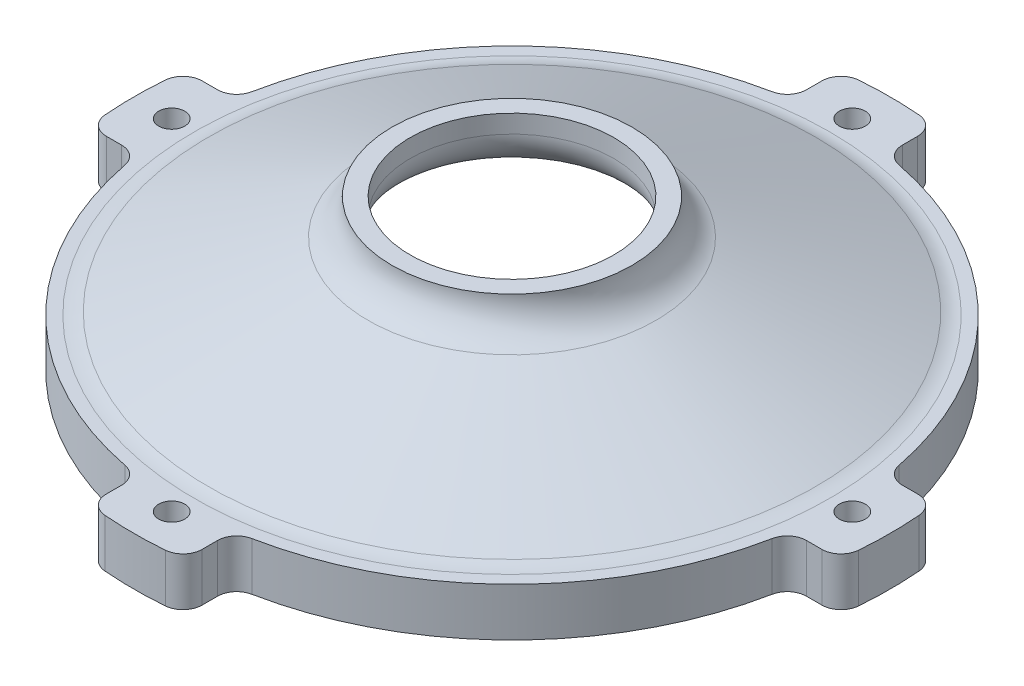
from build123d import *

# Parameters (mm, degrees)
F_18_0_1695_DIAMETER_HOLE1_D     = 4.3053
F_18_0_1695_DIAMETER_HOLE1_DEPTH = 38.1
F_18_0_1695_DIAMETER_HOLE1_TIP   = 1.293442612
CUT_EXTRUDE1_DEPTH               = 28


with BuildPart() as part:
    # Sketch2 → Revolve1 (revolve)
    with BuildSketch(Plane.XY, mode=Mode.PRIVATE) as revolve1_sk:
        with BuildLine():
            Line((50, 0), (62.5, 0))
            Line((62.5, 0), (62.5, 7.982495649))
            Line((62.5, 7.982495649), (52.5, 7.982495649))
            ThreePointArc((52.5, 7.982495649), (51.285053929, 8.09980714), (50.114998295, 8.447407131))
            Line((50.114998295, 8.447407131), (23.792498295, 19.114911482))
            ThreePointArc((23.792498295, 19.114911482), (20.911227085, 21.451920296), (19.8275, 25))
            Line((19.8275, 25), (16.8275, 25))
            Line((16.8275, 25), (16.8275, 22))
            ThreePointArc((16.8275, 22), (17.911227085, 18.451920296), (20.792498295, 16.114911482))
            Line((20.792498295, 16.114911482), (46.035001705, 5.885088518))
            ThreePointArc((46.035001705, 5.885088518), (48.916272915, 3.548079704), (50, 0))
        make_face()
    revolve(revolve1_sk.sketch.rotate(Axis((0, 0, 0), (0, 1, 0)), 90), axis=Axis((0, 0, 0), (0, 1, 0)))

    # #18 (0.1695) Diameter Hole1
    with Locations(Plane(origin=(0, 0, 0), x_dir=(-1, 0, 0), z_dir=(0, -1, 0))):
        with Locations((0, 56.25), (0, -56.25), (-56.25, 0), (56.25, 0)):
            Hole(F_18_0_1695_DIAMETER_HOLE1_D / 2, depth=F_18_0_1695_DIAMETER_HOLE1_DEPTH)
            with Locations((0, 0, -(F_18_0_1695_DIAMETER_HOLE1_DEPTH + F_18_0_1695_DIAMETER_HOLE1_TIP / 2))):  # 118° drill point
                Cone(0, F_18_0_1695_DIAMETER_HOLE1_D / 2, F_18_0_1695_DIAMETER_HOLE1_TIP, mode=Mode.SUBTRACT)

    # Sketch5 → Cut-Extrude1 (cut)
    with BuildSketch(Plane(origin=(0, 7.982495649, 0), x_dir=(1, 0, 0), z_dir=(0, 1, 0))):
        with BuildLine():
            Line((-56.597565166, 7.921), (-59.13485528, 7.921))
            ThreePointArc((-59.13485528, 7.921), (-61.28824505, 7.07913898), (-62.299678972, 5))
            ThreePointArc((-62.299678972, 5), (-44.194173824, 44.194173824), (-5, 62.299678972))
            ThreePointArc((-5, 62.299678972), (-7.07913898, 61.28824505), (-7.921, 59.13485528))
            Line((-7.921, 59.13485528), (-7.921, 56.597565166))
            ThreePointArc((-7.921, 56.597565166), (-8.644467885, 54.57998881), (-10.485166883, 53.48187801))
            ThreePointArc((-10.485166883, 53.48187801), (-38.537319575, 38.537319575), (-53.48187801, 10.485166883))
            ThreePointArc((-53.48187801, 10.485166883), (-54.57998881, 8.644467885), (-56.597565166, 7.921))
        make_face()
        with BuildLine():
            Line((7.921, 56.597565166), (7.921, 59.13485528))
            ThreePointArc((7.921, 59.13485528), (7.07913898, 61.28824505), (5, 62.299678972))
            ThreePointArc((5, 62.299678972), (44.194173824, 44.194173824), (62.299678972, 5))
            ThreePointArc((62.299678972, 5), (61.28824505, 7.07913898), (59.13485528, 7.921))
            Line((59.13485528, 7.921), (56.597565166, 7.921))
            ThreePointArc((56.597565166, 7.921), (54.57998881, 8.644467885), (53.48187801, 10.485166883))
            ThreePointArc((53.48187801, 10.485166883), (38.537319575, 38.537319575), (10.485166883, 53.48187801))
            ThreePointArc((10.485166883, 53.48187801), (8.644467885, 54.57998881), (7.921, 56.597565166))
        make_face()
        with BuildLine():
            Line((56.597565166, -7.921), (59.13485528, -7.921))
            ThreePointArc((59.13485528, -7.921), (61.28824505, -7.07913898), (62.299678972, -5))
            ThreePointArc((62.299678972, -5), (44.194173824, -44.194173824), (5, -62.299678972))
            ThreePointArc((5, -62.299678972), (7.07913898, -61.28824505), (7.921, -59.13485528))
            Line((7.921, -59.13485528), (7.921, -56.597565166))
            ThreePointArc((7.921, -56.597565166), (8.644467885, -54.57998881), (10.485166883, -53.48187801))
            ThreePointArc((10.485166883, -53.48187801), (38.537319575, -38.537319575), (53.48187801, -10.485166883))
            ThreePointArc((53.48187801, -10.485166883), (54.57998881, -8.644467885), (56.597565166, -7.921))
        make_face()
        with BuildLine():
            Line((-7.921, -56.597565166), (-7.921, -59.13485528))
            ThreePointArc((-7.921, -59.13485528), (-7.07913898, -61.28824505), (-5, -62.299678972))
            ThreePointArc((-5, -62.299678972), (-44.194173824, -44.194173824), (-62.299678972, -5))
            ThreePointArc((-62.299678972, -5), (-61.28824505, -7.07913898), (-59.13485528, -7.921))
            Line((-59.13485528, -7.921), (-56.597565166, -7.921))
            ThreePointArc((-56.597565166, -7.921), (-54.57998881, -8.644467885), (-53.48187801, -10.485166883))
            ThreePointArc((-53.48187801, -10.485166883), (-38.537319575, -38.537319575), (-10.485166883, -53.48187801))
            ThreePointArc((-10.485166883, -53.48187801), (-8.644467885, -54.57998881), (-7.921, -56.597565166))
        make_face()
    extrude(amount=-CUT_EXTRUDE1_DEPTH, mode=Mode.SUBTRACT)


solid = part.part
